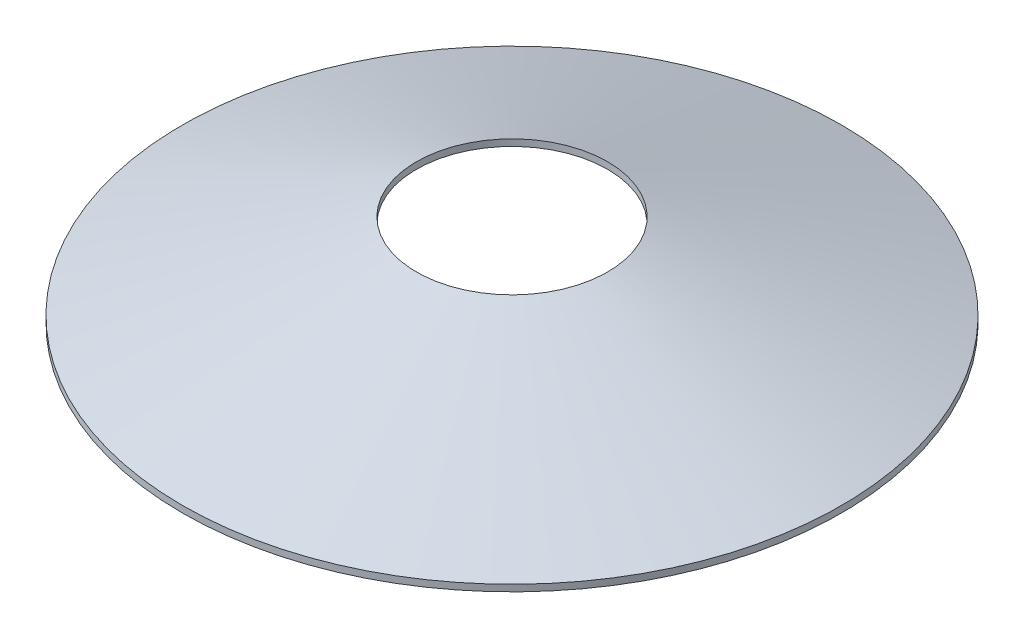
from build123d import *

# Parameters (mm, degrees)
SCHIZZO4_R               = 29
TAGLIO_ESTRUSIONE1_DEPTH = 145.996551683


with BuildPart() as part:
    # Schizzo1 → Rivoluzione1 (revolve)
    with BuildSketch(Plane.XY, mode=Mode.PRIVATE) as rivoluzione1_sk:
        Polygon((-17.575677416, -2), (0, -2), (0, 0), (-17.575677416, 0), (-100, -30), (-100, -32), align=None)
    revolve(rivoluzione1_sk.sketch.rotate(Axis((0, -2, 0), (0, 1, 0)), 270), axis=Axis((0, -2, 0), (0, 1, 0)))

    # Schizzo4 → Taglio-Estrusione1 (cut, through all)
    with BuildSketch(Plane(origin=(0, 0, 0), x_dir=(1, 0, 0), z_dir=(0, 1, 0))):
        with Locations(Location((0, 0, 0), (0, 0, 90))):
            Circle(SCHIZZO4_R)
    extrude(amount=-TAGLIO_ESTRUSIONE1_DEPTH, mode=Mode.SUBTRACT)


solid = part.part
